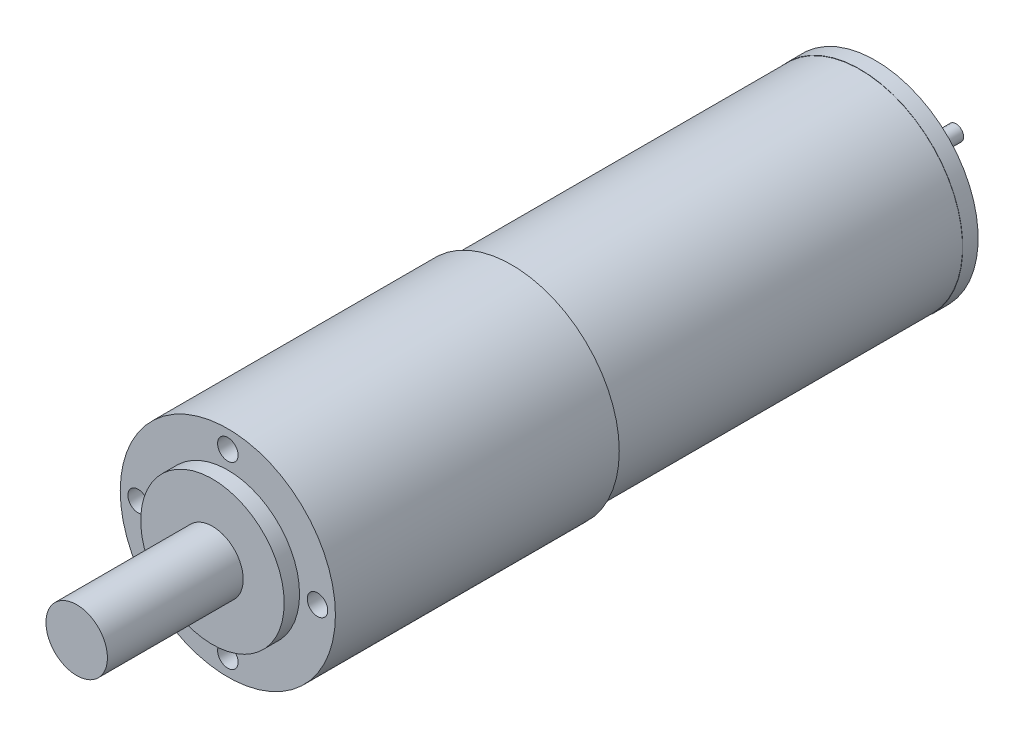
from build123d import *

# Parameters (mm, degrees)
ESQUISSE1_R             = 20
BOSS_EXTRU_1_DEPTH      = 71
ESQUISSE2_R             = 4
BOSS_EXTRU_2_DEPTH      = 1.35
ESQUISSE3_R             = 1.5
BOSS_EXTRU_3_DEPTH      = 15.7
ESQUISSE11_R            = 20.05
BOSS_EXTRU_8_DEPTH      = 3
ESQUISSE12_R            = 1
ESQUISSE12_R_2          = 0.8
ENL_V_MAT_EXTRU_4_DEPTH = 1
ESQUISSE4_R             = 21
BOSS_EXTRU_9_DEPTH      = 55.4
ESQUISSE13_R            = 14
BOSS_EXTRU_10_DEPTH     = 3
ESQUISSE14_R            = 6
BOSS_EXTRU_11_DEPTH     = 26.5
ESQUISSE15_R            = 2
ENL_V_MAT_EXTRU_5_DEPTH = 6


with BuildPart() as part:
    # Esquisse1 → Boss.-Extru.1 (new body)
    with BuildSketch(Plane.XY):
        Circle(ESQUISSE1_R)
    extrude(amount=BOSS_EXTRU_1_DEPTH)

    # Esquisse2 → Boss.-Extru.2 (add)
    with BuildSketch(Plane(origin=(0, 0, 0), x_dir=(-1, 0, 0), z_dir=(0, 0, -1))):
        with Locations(Location((0, 0, 0), (0, 0, 180))):
            Circle(ESQUISSE2_R)
    extrude(amount=BOSS_EXTRU_2_DEPTH)

    # Esquisse3 → Boss.-Extru.3 (add)
    with BuildSketch(Plane(origin=(0, 0, 0), x_dir=(-1, 0, 0), z_dir=(0, 0, -1))):
        Circle(ESQUISSE3_R)
    extrude(amount=BOSS_EXTRU_3_DEPTH)

    # Esquisse11 → Boss.-Extru.8 (add)
    with BuildSketch(Plane(origin=(0, 0, 0), x_dir=(-1, 0, 0), z_dir=(0, 0, -1))):
        Circle(ESQUISSE11_R)
    extrude(amount=-BOSS_EXTRU_8_DEPTH)

    # Esquisse12 → Enlèv. mat.-Extru.4 (cut)
    with BuildSketch(Plane(origin=(0, 0, 0), x_dir=(-1, 0, 0), z_dir=(0, 0, -1))):
        with Locations((1.720688849, -15.102292206)):
            Circle(ESQUISSE12_R)
        with Locations((-1.720688849, 15.102292206)):
            Circle(ESQUISSE12_R)
        with Locations((-12.218624281, -9.041306359)):
            Circle(ESQUISSE12_R)
        with Locations((10.20898213, 7.554249392)):
            Circle(ESQUISSE12_R_2)
        with Locations((-10.20898213, -7.554249392)):
            Circle(ESQUISSE12_R_2)
        with Locations((-9.041306359, 12.218624281)):
            Circle(ESQUISSE12_R)
        with Locations((12.218624281, 9.041306359)):
            Circle(ESQUISSE12_R)
        with Locations((9.041306359, -12.218624281)):
            Circle(ESQUISSE12_R)
        Polygon((13.553659243, -1.043501598), (19.3492142, -2.596415868), (18.055118975, -7.426045), (12.259564017, -5.873130729), align=None)
        Polygon((-13.584662099, -0.497523966), (-19.51875728, 0.389332501), (-18.779710224, 5.334411818), (-12.845615044, 4.447555351), align=None)
    extrude(amount=-ENL_V_MAT_EXTRU_4_DEPTH, mode=Mode.SUBTRACT)

    # Esquisse4 → Boss.-Extru.9 (add)
    with BuildSketch(Plane.XY.offset(71)):
        Circle(ESQUISSE4_R)
    extrude(amount=BOSS_EXTRU_9_DEPTH)

    # Esquisse13 → Boss.-Extru.10 (add)
    with BuildSketch(Plane.XY.offset(126.4)):
        Circle(ESQUISSE13_R)
    extrude(amount=BOSS_EXTRU_10_DEPTH)

    # Esquisse14 → Boss.-Extru.11 (add)
    with BuildSketch(Plane.XY.offset(129.4)):
        Circle(ESQUISSE14_R)
    extrude(amount=BOSS_EXTRU_11_DEPTH)

    # Esquisse15 → Enlèv. mat.-Extru.5 (cut)
    with BuildSketch(Plane.XY.offset(126.4)):
        with Locations((0, -17.5)):
            Circle(ESQUISSE15_R)
        with Locations((-17.5, 0)):
            Circle(ESQUISSE15_R)
        with Locations((0, 17.5)):
            Circle(ESQUISSE15_R)
        with Locations((17.5, 0)):
            Circle(ESQUISSE15_R)
    extrude(amount=-ENL_V_MAT_EXTRU_5_DEPTH, mode=Mode.SUBTRACT)


solid = part.part
